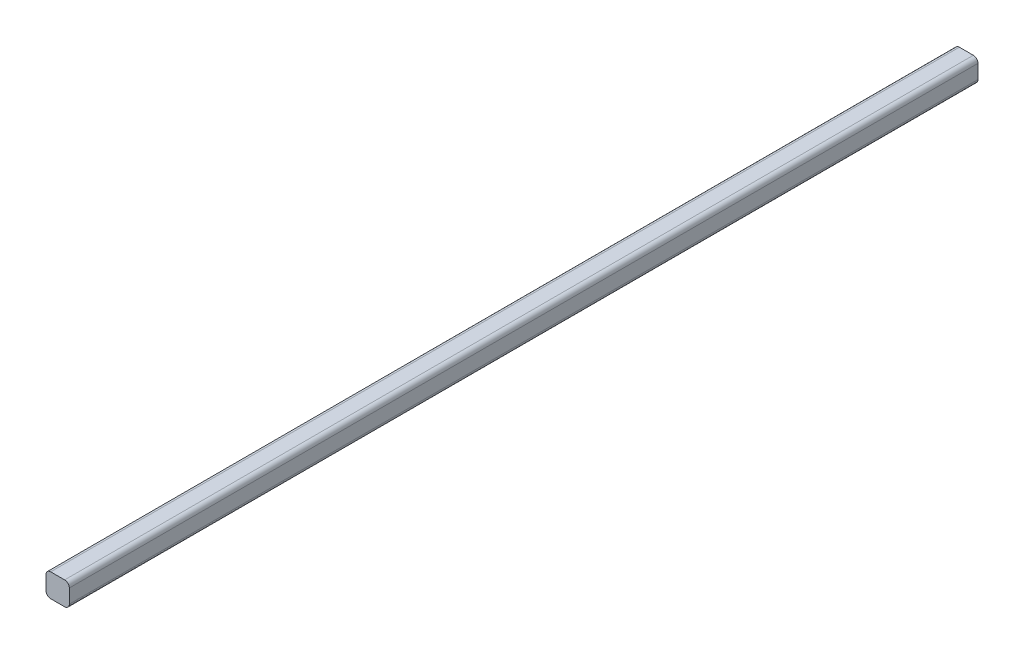
from build123d import *

# Parameters (mm, degrees)
ESQUISSE1_W        = 50
ESQUISSE1_H        = 50
BOSS_EXTRU_1_DEPTH = 1950
CONG_1_R           = 10


with BuildPart() as part:
    # Esquisse1 → Boss.-Extru.1 (new body)
    with BuildSketch(Plane.XY):
        with Locations((25, 25)):
            Rectangle(ESQUISSE1_W, ESQUISSE1_H)
    extrude(amount=BOSS_EXTRU_1_DEPTH)

    # Congé1
    cong_1_edges = [part.edges().sort_by_distance(p)[0] for p in [
        (0, 50, 975),
        (50, 50, 975),
        (50, 0, 975),
        (0, 0, 975),
    ]]
    fillet(cong_1_edges, radius=CONG_1_R)


solid = part.part
